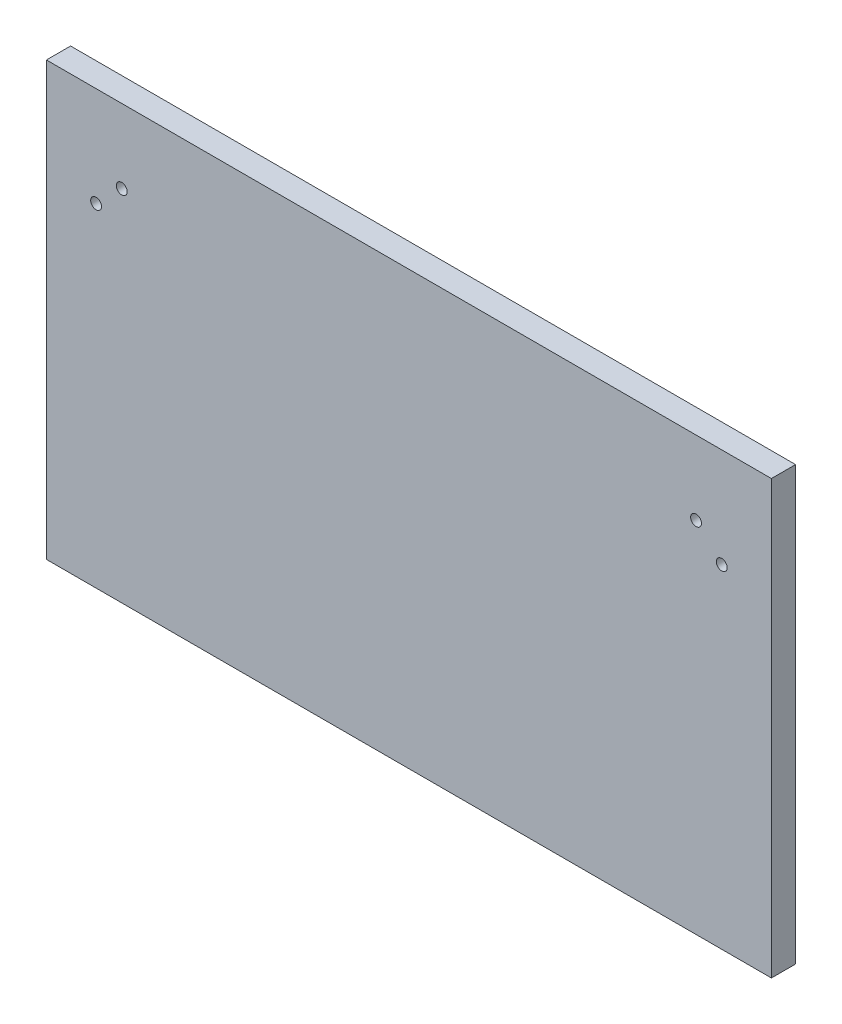
from build123d import *

# Parameters (mm, degrees)
SCHIZZO1_W                   = 300
SCHIZZO1_H                   = 179
ESTRUSIONE_ESTRUSIONE1_DEPTH = 10
SCHIZZO3_R                   = 2.25
TAGLIO_ESTRUSIONE2_DEPTH     = 10


with BuildPart() as part:
    # Schizzo1 → Estrusione-Estrusione1 (new body)
    with BuildSketch(Plane.XY):
        with Locations((-150, 89.5)):
            Rectangle(SCHIZZO1_W, SCHIZZO1_H)
    extrude(amount=ESTRUSIONE_ESTRUSIONE1_DEPTH)

    # Schizzo3 → Taglio-Estrusione2 (cut)
    with BuildSketch(Plane.XY.offset(10)):
        with Locations((-31.161165235, 148.445436483)):
            Circle(SCHIZZO3_R)
        with Locations((-20.554563517, 137.838834765)):
            Circle(SCHIZZO3_R)
        with Locations((-268.838834765, 148.445436483)):
            Circle(SCHIZZO3_R)
        with Locations((-279.445436483, 137.838834765)):
            Circle(SCHIZZO3_R)
    extrude(amount=-TAGLIO_ESTRUSIONE2_DEPTH, mode=Mode.SUBTRACT)


solid = part.part
